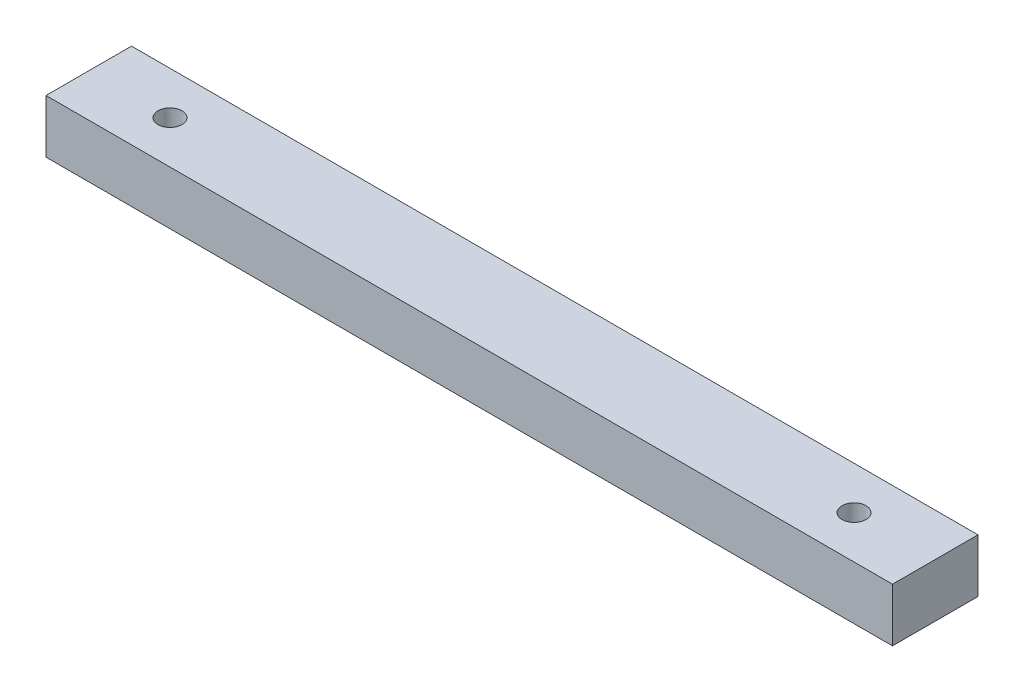
from build123d import *

# Parameters (mm, degrees)
SKETCH3_W               = 25.4
SKETCH3_H               = 15.875
EXTRUDE2_DEPTH          = 125.73
F_1_4_CLEARANCE_HOLE1_D = 7.14248


with BuildPart() as part:
    # Sketch3 → Extrude2 (new, symmetric)
    with BuildSketch(Plane(origin=(0, 0, 0), x_dir=(0, 0, -1), z_dir=(1, 0, 0))):
        Rectangle(SKETCH3_W, SKETCH3_H)
    extrude(amount=EXTRUDE2_DEPTH, both=True)

    # 1/4 Clearance Hole1 (through all)
    with Locations(Plane(origin=(101.6, 7.9375, 0), x_dir=(0, 0, 1), z_dir=(0, 1, 0))):
        with Locations((0, 0), (0, -203.2)):
            Hole(F_1_4_CLEARANCE_HOLE1_D / 2)


solid = part.part
